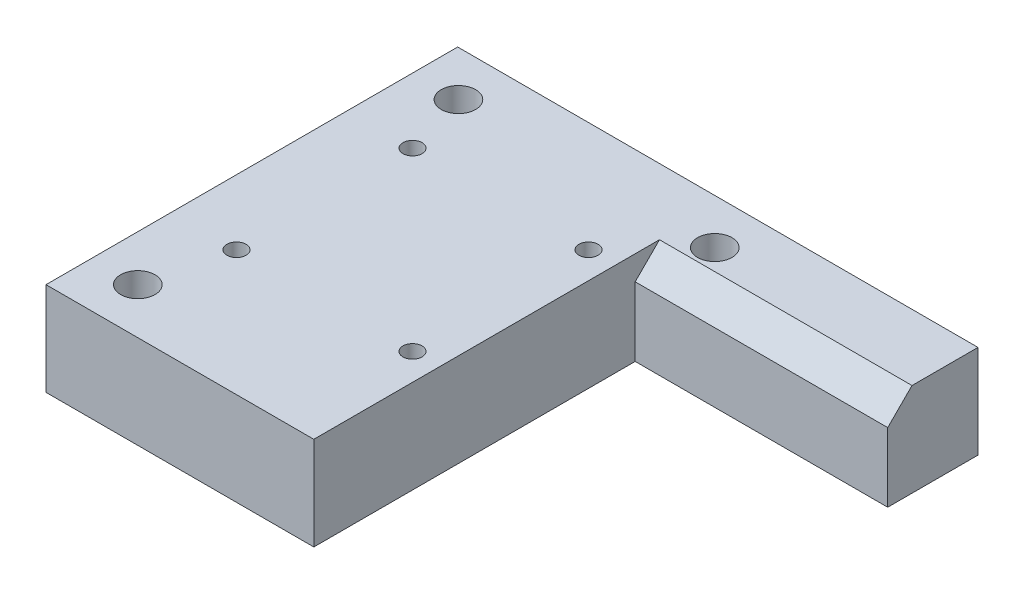
from build123d import *

# Parameters (mm, degrees)
SKETCH1_W           = 68
SKETCH1_H           = 12.192
BOSS_EXTRUDE1_DEPTH = 11.8
SKETCH2_R           = 2.25
CUT_EXTRUDE1_DEPTH  = 71.084840472
SKETCH3_R           = 4.125
CUT_EXTRUDE2_DEPTH  = 7
SKETCH4_W           = 35
SKETCH4_H           = 12.192
BOSS_EXTRUDE2_DEPTH = 42
SKETCH5_R           = 2.25
CUT_EXTRUDE3_DEPTH  = 88.56189162
SKETCH6_R           = 4.125
CUT_EXTRUDE4_DEPTH  = 7
CUT_EXTRUDE5_REACH  = 89.562
SKETCH7_R           = 1.25
CHAMFER1_SIZE       = 3.175
SKETCH_1_W          = 81.955922865
SKETCH_1_H          = 24.411559288
CUT_EXTRUDE_1_DEPTH = 88.56189162


with BuildPart() as part:
    # Sketch1 → Boss-Extrude1 (new body)
    with BuildSketch(Plane.XY):
        with Locations((34, -6.096)):
            Rectangle(SKETCH1_W, SKETCH1_H)
    extrude(amount=BOSS_EXTRUDE1_DEPTH)

    # Sketch2 → Cut-Extrude1 (cut, through all)
    with BuildSketch(Plane(origin=(0, 0, 0), x_dir=(1, 0, 0), z_dir=(0, 1, 0))):
        with Locations(Location((39.5, -5.9, 0), (0, 0, 270))):
            Circle(SKETCH2_R)
        with Locations(Location((6, -5.9, 0), (0, 0, 270))):
            Circle(SKETCH2_R)
    extrude(amount=-CUT_EXTRUDE1_DEPTH, mode=Mode.SUBTRACT)

    # Sketch3 → Cut-Extrude2 (cut)
    with BuildSketch(Plane(origin=(0, 0, 0), x_dir=(1, 0, 0), z_dir=(0, 1, 0))):
        with Locations(Location((39.5, -5.9, 0), (0, 0, 270))):
            Circle(SKETCH3_R)
        with Locations(Location((6, -5.9, 0), (0, 0, 270))):
            Circle(SKETCH3_R)
    extrude(amount=-CUT_EXTRUDE2_DEPTH, mode=Mode.SUBTRACT)

    # Sketch4 → Boss-Extrude2 (add)
    with BuildSketch(Plane.XY.offset(11.8)):
        with Locations((17.5, -6.096)):
            Rectangle(SKETCH4_W, SKETCH4_H)
    extrude(amount=BOSS_EXTRUDE2_DEPTH)

    # Sketch5 → Cut-Extrude3 (cut, through all)
    with BuildSketch(Plane(origin=(0, 0, 0), x_dir=(1, 0, 0), z_dir=(0, 1, 0))):
        with Locations(Location((6, -47.8, 0), (0, 0, 270))):
            Circle(SKETCH5_R)
    extrude(amount=-CUT_EXTRUDE3_DEPTH, mode=Mode.SUBTRACT)

    # Sketch6 → Cut-Extrude4 (cut)
    with BuildSketch(Plane(origin=(0, 0, 0), x_dir=(1, 0, 0), z_dir=(0, 1, 0))):
        with Locations(Location((6, -47.8, 0), (0, 0, 270))):
            Circle(SKETCH6_R)
    extrude(amount=-CUT_EXTRUDE4_DEPTH, mode=Mode.SUBTRACT)

    # Sketch7 → Cut-Extrude5 (cut, up to next)
    with BuildSketch(Plane(origin=(0, 0, 0), x_dir=(1, 0, 0), z_dir=(0, 1, 0)), mode=Mode.PRIVATE) as cut_extrude5_sk1:
        with Locations(Location((8.5, -14.400241512, 0), (0, 0, 270))):
            Circle(SKETCH7_R)
    cut_extrude5_tool1 = extrude(cut_extrude5_sk1.sketch, amount=-CUT_EXTRUDE5_REACH, mode=Mode.PRIVATE) & part.part
    # Sketch7 → Cut-Extrude5 (cut, up to next)
    with BuildSketch(Plane(origin=(0, 0, 0), x_dir=(1, 0, 0), z_dir=(0, 1, 0)), mode=Mode.PRIVATE) as cut_extrude5_sk2:
        with Locations(Location((8.497816512, -37.402425, 0), (0, 0, 270))):
            Circle(SKETCH7_R)
    cut_extrude5_tool2 = extrude(cut_extrude5_sk2.sketch, amount=-CUT_EXTRUDE5_REACH, mode=Mode.PRIVATE) & part.part
    # Sketch7 → Cut-Extrude5 (cut, up to next)
    with BuildSketch(Plane(origin=(0, 0, 0), x_dir=(1, 0, 0), z_dir=(0, 1, 0)), mode=Mode.PRIVATE) as cut_extrude5_sk3:
        with Locations(Location((31.5, -37.404608488, 0), (0, 0, 270))):
            Circle(SKETCH7_R)
    cut_extrude5_tool3 = extrude(cut_extrude5_sk3.sketch, amount=-CUT_EXTRUDE5_REACH, mode=Mode.PRIVATE) & part.part
    # Sketch7 → Cut-Extrude5 (cut, up to next)
    with BuildSketch(Plane(origin=(0, 0, 0), x_dir=(1, 0, 0), z_dir=(0, 1, 0)), mode=Mode.PRIVATE) as cut_extrude5_sk4:
        with Locations(Location((31.502183488, -14.402425, 0), (0, 0, 270))):
            Circle(SKETCH7_R)
    cut_extrude5_tool4 = extrude(cut_extrude5_sk4.sketch, amount=-CUT_EXTRUDE5_REACH, mode=Mode.PRIVATE) & part.part
    add(cut_extrude5_tool1.solids().sort_by_distance((8.5, 0, 14.400242))[0], mode=Mode.SUBTRACT)
    add(cut_extrude5_tool2.solids().sort_by_distance((8.497817, 0, 37.402425))[0], mode=Mode.SUBTRACT)
    add(cut_extrude5_tool3.solids().sort_by_distance((31.5, 0, 37.404608))[0], mode=Mode.SUBTRACT)
    add(cut_extrude5_tool4.solids().sort_by_distance((31.502183, 0, 14.402425))[0], mode=Mode.SUBTRACT)

    # Chamfer1
    chamfer1_edges = [part.edges().sort_by_distance(p)[0] for p in [
        (51.5, -12.192, 11.8),
    ]]
    chamfer(chamfer1_edges, length=CHAMFER1_SIZE)

    # 镜向1: part across plane


with BuildPart() as part_1:
    add(part.part)
    add(part.part.mirror(Plane.ZX))

    # 草图1 → 切除-拉伸1 (cut, through all)
    with BuildSketch(Plane.XY.offset(53.8)):
        with Locations((40.977961433, -12.205779644)):
            Rectangle(SKETCH_1_W, SKETCH_1_H)
    extrude(amount=-CUT_EXTRUDE_1_DEPTH, mode=Mode.SUBTRACT)


solid = part_1.part
